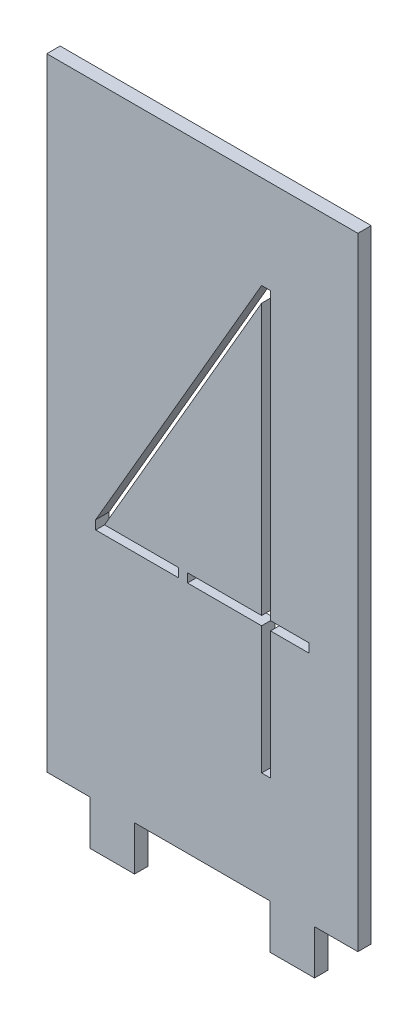
from build123d import *

# Parameters (mm, degrees)
SKIZZE1_W                        = 35
SKIZZE1_H                        = 75
AUFSATZ_LINEAR_AUSTRAGEN1_DEPTH  = 1.5
SKIZZE3_W                        = 15.25
SKIZZE3_H                        = 5
SKIZZE3_W_2                      = 4.875
SCHNITT_LINEAR_AUSTRAGEN12_DEPTH = 20
SCHNITT_LINEAR_AUSTRAGEN15_DEPTH = 1.5
SKIZZE9_W                        = 1
SKIZZE9_H                        = 5.796251951
AUFSATZ_LINEAR_AUSTRAGEN6_DEPTH  = 1.5


with BuildPart() as part:
    # Skizze1 → Aufsatz-Linear austragen1 (new body)
    with BuildSketch(Plane.XY):
        with Locations((17.5, 37.5)):
            Rectangle(SKIZZE1_W, SKIZZE1_H)
    extrude(amount=AUFSATZ_LINEAR_AUSTRAGEN1_DEPTH)

    # Skizze3 → Schnitt-Linear austragen12 (cut)
    with BuildSketch(Plane.XY.offset(1.5)):
        with Locations((17.5, 2.5)):
            Rectangle(SKIZZE3_W, SKIZZE3_H)
        with Locations((32.5625, 2.5)):
            Rectangle(SKIZZE3_W_2, SKIZZE3_H)
        with Locations((2.4375, 2.5)):
            Rectangle(SKIZZE3_W_2, SKIZZE3_H)
    extrude(amount=-SCHNITT_LINEAR_AUSTRAGEN12_DEPTH, mode=Mode.SUBTRACT)

    # Skizze8 → Schnitt-Linear austragen15 (cut)
    with BuildSketch(Plane.XY.offset(1.5)):
        Polygon((5.5, 32.342192337), (24.167481122, 64.5), (25.167481122, 64.5), (25.167481122, 32.342192337), (29.5, 32.342192337), (29.5, 31.342192337), (25.167481122, 31.342192337), (25.167481122, 17), (24.167481122, 17), (24.167481122, 31.342192337), (5.5, 31.342192337), align=None)
        Polygon((6.5, 32.342192337), (24.167481122, 32.342192337), (24.167481122, 62.777335466), align=None, mode=Mode.SUBTRACT)
    extrude(amount=-SCHNITT_LINEAR_AUSTRAGEN15_DEPTH, mode=Mode.SUBTRACT)


with BuildPart() as schnitt_linear_austragen15_piece_1:
    # of the separate pieces the step leaves, piece 1, a body of its own (schnitt_linear_austragen15_pieces)
    add(part.part.solids().sort_by_distance((4.875, 0, 0))[0])



with BuildPart() as schnitt_linear_austragen15_piece_2:
    # of the separate pieces the step leaves, piece 2, a body of its own (schnitt_linear_austragen15_pieces)
    add(part.part.solids().sort_by_distance((24.167481122, 62.777335466, 0))[0])


with BuildPart() as schnitt_linear_austragen15_piece_1_1:
    add(schnitt_linear_austragen15_piece_1.part)

    add(schnitt_linear_austragen15_piece_2.part)  # Aufsatz-Linear austragen6 merges Schnitt-Linear austragen15 piece 2
    # Skizze9 → Aufsatz-Linear austragen6 (add)
    with BuildSketch(Plane.XY.offset(1.5)):
        with Locations((15.327481122, 31.334841656)):
            Rectangle(SKIZZE9_W, SKIZZE9_H)
    extrude(amount=-AUFSATZ_LINEAR_AUSTRAGEN6_DEPTH)


solid = schnitt_linear_austragen15_piece_1_1.part
